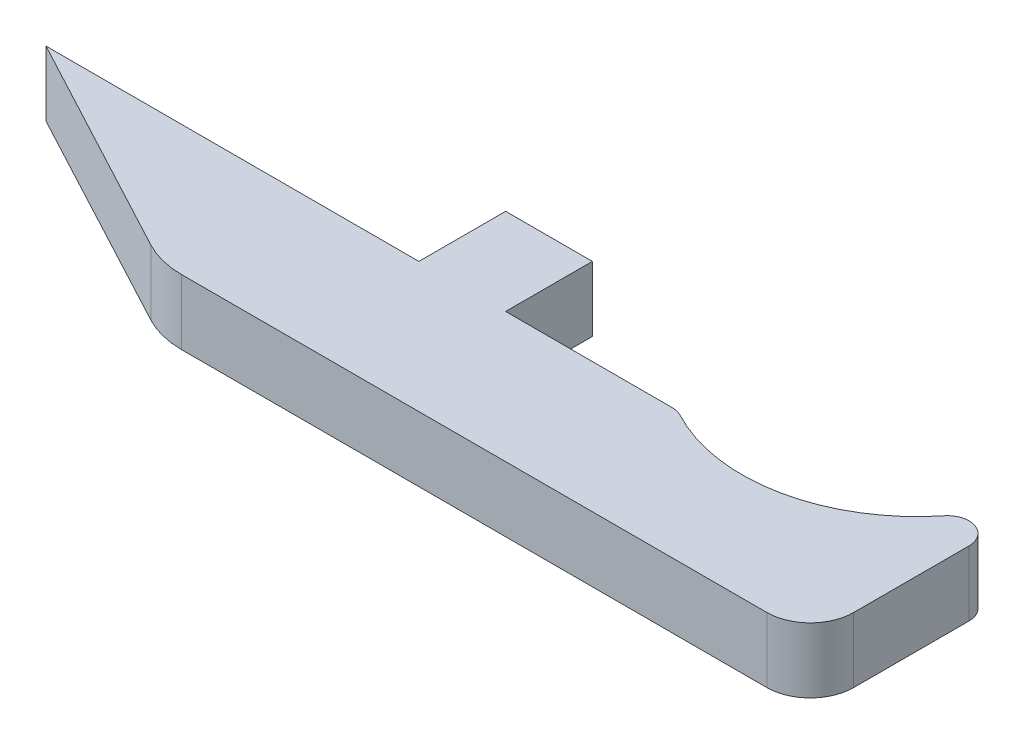
from build123d import *

# Parameters (mm, degrees)
BOSS_EXTRUDE1_DEPTH = 4.7625
FILLET1_R           = 1.5875
FILLET2_R           = 6.35
FILLET3_R           = 3.175
SKETCH2_W           = 6.35
SKETCH2_H           = 4.7625
BOSS_EXTRUDE2_DEPTH = 6.35


with BuildPart() as part:
    # Sketch1 → Boss-Extrude1 (new body)
    with BuildSketch(Plane(origin=(0, 0, 0), x_dir=(1, 0, 0), z_dir=(0, 1, 0))):
        with BuildLine():
            ThreePointArc((71.770239996, -31.454230992), (65.371223106, -42.55436442), (52.558738922, -42.579430992))
            Line((52.558738922, -42.579430992), (6.2845, -42.579430992))
            Line((6.2845, -42.579430992), (24.145239996, -52.104430992))
            Line((24.145239996, -52.104430992), (71.770239996, -52.104430992))
            Line((71.770239996, -52.104430992), (71.770239996, -31.454230992))
        make_face()
    extrude(amount=BOSS_EXTRUDE1_DEPTH)

    # Fillet1
    fillet1_edges = [part.edges().sort_by_distance(p)[0] for p in [
        (71.770239996, 2.38125, 31.454230992),
        (52.558738922, 2.38125, 42.579430992),
    ]]
    fillet(fillet1_edges, radius=FILLET1_R)

    # Fillet2
    fillet2_edges = [part.edges().sort_by_distance(p)[0] for p in [
        (24.145239996, 2.38125, 52.104430992),
    ]]
    fillet(fillet2_edges, radius=FILLET2_R)

    # Fillet3
    fillet3_edges = [part.edges().sort_by_distance(p)[0] for p in [
        (71.770239996, 2.38125, 52.104430992),
    ]]
    fillet(fillet3_edges, radius=FILLET3_R)

    # Sketch2 → Boss-Extrude2 (add)
    with BuildSketch(Plane(origin=(0, 0, 42.579430992), x_dir=(-1, 0, 0), z_dir=(0, 0, -1))):
        with Locations((-36.7645, 2.38125)):
            Rectangle(SKETCH2_W, SKETCH2_H)
    extrude(amount=BOSS_EXTRUDE2_DEPTH)


solid = part.part
